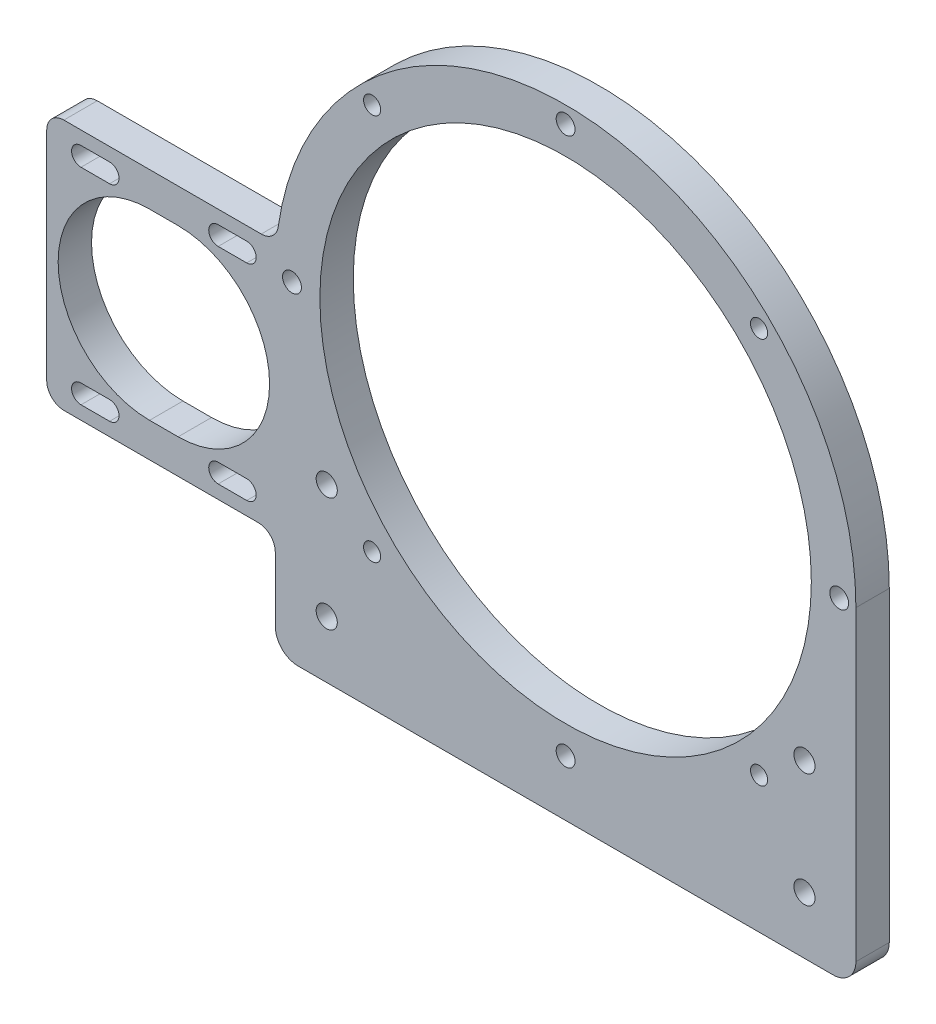
from build123d import *

# Parameters (mm, degrees)
SKETCH1_R           = 1.85
SKETCH1_R_2         = 1.5
SKETCH1_R_3         = 1.65
SKETCH1_R_4         = 43
BOSS_EXTRUDE1_DEPTH = 5.842
FILLET1_R           = 4
BOSS_EXTRUDE2_DEPTH = 5.842
FILLET2_R           = 3


with BuildPart() as part:
    # Sketch1 → Boss-Extrude1 (new body)
    # profile 1 of 2: a face of its own
    with BuildSketch(Plane.XY):
        with BuildLine():
            ThreePointArc((50.8, 0), (0, 50.8), (-50.8, 0))
            Line((-50.8, 0), (-50.8, -57.658))
            Line((-50.8, -57.658), (0, -57.658))
            Line((0, -57.658), (50.8, -57.658))
            Line((50.8, -57.658), (50.8, 0))
        make_face()
        with Locations((-41.8, -47.658)):
            Circle(SKETCH1_R, mode=Mode.SUBTRACT)
        with Locations((-33.855565576, -33.855565576)):
            Circle(SKETCH1_R_2, mode=Mode.SUBTRACT)
        with Locations((-41.8, -27.658)):
            Circle(SKETCH1_R, mode=Mode.SUBTRACT)
        with Locations((0, -47.879)):
            Circle(SKETCH1_R_3, mode=Mode.SUBTRACT)
        with Locations((41.8, -47.658)):
            Circle(SKETCH1_R, mode=Mode.SUBTRACT)
        with Locations((33.855565576, -33.855565576)):
            Circle(SKETCH1_R_2, mode=Mode.SUBTRACT)
        with Locations((41.8, -27.658)):
            Circle(SKETCH1_R, mode=Mode.SUBTRACT)
        with Locations((-47.879, 0)):
            Circle(SKETCH1_R_3, mode=Mode.SUBTRACT)
        Circle(SKETCH1_R_4, mode=Mode.SUBTRACT)
        with Locations((-33.855565576, 33.855565576)):
            Circle(SKETCH1_R_2, mode=Mode.SUBTRACT)
        with Locations((0, 47.879)):
            Circle(SKETCH1_R_3, mode=Mode.SUBTRACT)
        with Locations((47.879, 0)):
            Circle(SKETCH1_R_3, mode=Mode.SUBTRACT)
        with Locations((33.855565576, 33.855565576)):
            Circle(SKETCH1_R_2, mode=Mode.SUBTRACT)
    # profile 2 of 2: a face of its own
    with BuildSketch(Plane.XY):
        with BuildLine():
            ThreePointArc((50.8, 0), (0, 50.8), (-50.8, 0))
            Line((-50.8, 0), (-50.8, -57.658))
            Line((-50.8, -57.658), (0, -57.658))
            Line((0, -57.658), (50.8, -57.658))
            Line((50.8, -57.658), (50.8, 0))
        make_face()
        with Locations((-41.8, -47.658)):
            Circle(SKETCH1_R, mode=Mode.SUBTRACT)
        with Locations((-33.855565576, -33.855565576)):
            Circle(SKETCH1_R_2, mode=Mode.SUBTRACT)
        with Locations((-41.8, -27.658)):
            Circle(SKETCH1_R, mode=Mode.SUBTRACT)
        with Locations((0, -47.879)):
            Circle(SKETCH1_R_3, mode=Mode.SUBTRACT)
        with Locations((41.8, -47.658)):
            Circle(SKETCH1_R, mode=Mode.SUBTRACT)
        with Locations((33.855565576, -33.855565576)):
            Circle(SKETCH1_R_2, mode=Mode.SUBTRACT)
        with Locations((41.8, -27.658)):
            Circle(SKETCH1_R, mode=Mode.SUBTRACT)
        with Locations((-47.879, 0)):
            Circle(SKETCH1_R_3, mode=Mode.SUBTRACT)
        Circle(SKETCH1_R_4, mode=Mode.SUBTRACT)
        with Locations((-33.855565576, 33.855565576)):
            Circle(SKETCH1_R_2, mode=Mode.SUBTRACT)
        with Locations((0, 47.879)):
            Circle(SKETCH1_R_3, mode=Mode.SUBTRACT)
        with Locations((47.879, 0)):
            Circle(SKETCH1_R_3, mode=Mode.SUBTRACT)
        with Locations((33.855565576, 33.855565576)):
            Circle(SKETCH1_R_2, mode=Mode.SUBTRACT)
    extrude(amount=BOSS_EXTRUDE1_DEPTH)

    # Fillet1
    fillet1_edges = [part.edges().sort_by_distance(p)[0] for p in [
        (50.8, -57.658, 2.921),
        (-50.8, -57.658, 2.921),
    ]]
    fillet(fillet1_edges, radius=FILLET1_R)

    # Sketch2 → Boss-Extrude2 (add, through all)
    with BuildSketch(Plane.XY.offset(5.842)):
        Polygon((-50.592347052, 4.588509541), (-90.8, 4.588509541), (-90.8, -39.411490459), (-50.8, -39.411490459), align=None)
        with BuildLine():
            Line((-67.8, -33.411490459), (-72.8, -33.411490459))
            ThreePointArc((-72.8, -33.411490459), (-88.8, -17.411490459), (-72.8, -1.411490459))
            Line((-72.8, -1.411490459), (-67.8, -1.411490459))
            ThreePointArc((-67.8, -1.411490459), (-51.8, -17.411490459), (-67.8, -33.411490459))
        make_face(mode=Mode.SUBTRACT)
        with BuildLine():
            Line((-79.8, -1.061490459), (-84.8, -1.061490459))
            ThreePointArc((-84.8, -1.061490459), (-86.45, 0.588509541), (-84.8, 2.238509541))
            Line((-84.8, 2.238509541), (-79.8, 2.238509541))
            ThreePointArc((-79.8, 2.238509541), (-78.15, 0.588509541), (-79.8, -1.061490459))
        make_face(mode=Mode.SUBTRACT)
        with BuildLine():
            Line((-55.8, -1.061490459), (-60.8, -1.061490459))
            ThreePointArc((-60.8, -1.061490459), (-62.45, 0.588509541), (-60.8, 2.238509541))
            Line((-60.8, 2.238509541), (-55.8, 2.238509541))
            ThreePointArc((-55.8, 2.238509541), (-54.15, 0.588509541), (-55.8, -1.061490459))
        make_face(mode=Mode.SUBTRACT)
        with BuildLine():
            Line((-55.8, -37.061490459), (-60.8, -37.061490459))
            ThreePointArc((-60.8, -37.061490459), (-62.45, -35.411490459), (-60.8, -33.761490459))
            Line((-60.8, -33.761490459), (-55.8, -33.761490459))
            ThreePointArc((-55.8, -33.761490459), (-54.15, -35.411490459), (-55.8, -37.061490459))
        make_face(mode=Mode.SUBTRACT)
        with BuildLine():
            Line((-79.8, -37.061490459), (-84.8, -37.061490459))
            ThreePointArc((-84.8, -37.061490459), (-86.45, -35.411490459), (-84.8, -33.761490459))
            Line((-84.8, -33.761490459), (-79.8, -33.761490459))
            ThreePointArc((-79.8, -33.761490459), (-78.15, -35.411490459), (-79.8, -37.061490459))
        make_face(mode=Mode.SUBTRACT)
    extrude(amount=-BOSS_EXTRUDE2_DEPTH)

    # Fillet2
    fillet2_edges = [part.edges().sort_by_distance(p)[0] for p in [
        (-50.592347052, 4.588509541, 2.921),
        (-50.8, -39.411490459, 2.921),
        (-90.8, -39.411490459, 2.921),
        (-90.8, 4.588509541, 2.921),
    ]]
    fillet(fillet2_edges, radius=FILLET2_R)


solid = part.part
